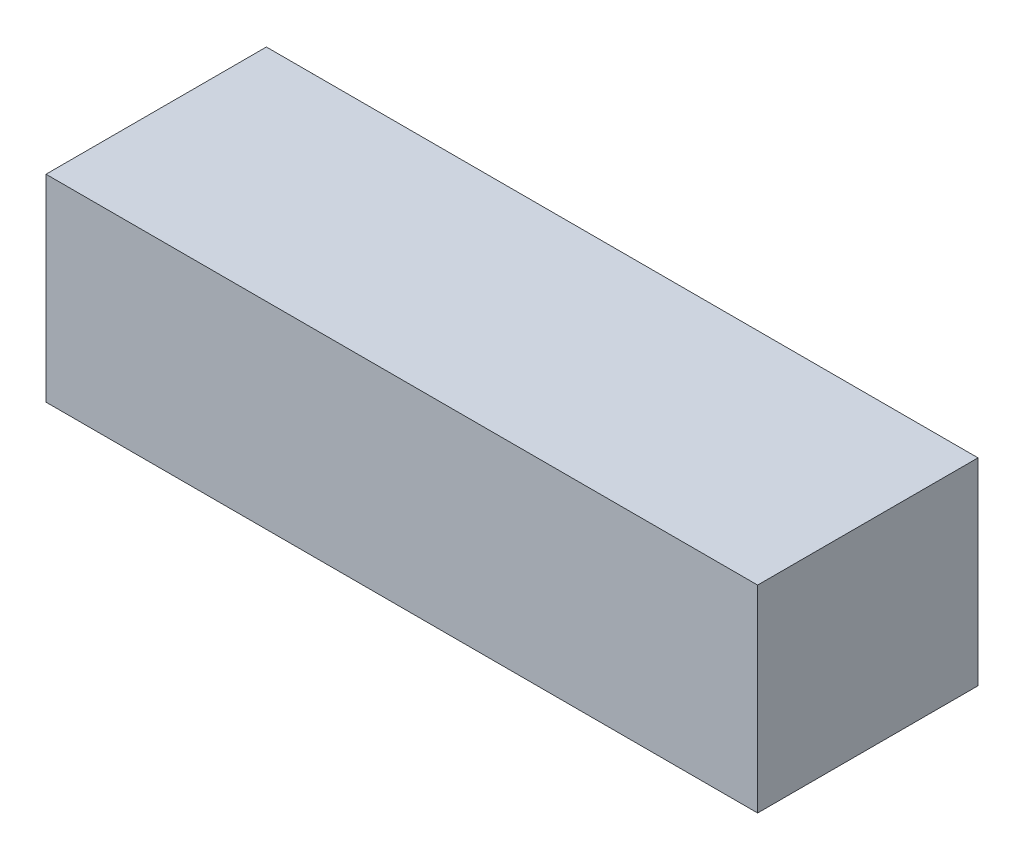
from build123d import *

# Parameters (mm, degrees)
SCHIZZO1_W                   = 155
SCHIZZO1_H                   = 48
ESTRUSIONE_ESTRUSIONE1_DEPTH = 43


with BuildPart() as part:
    # Schizzo1 → Estrusione-Estrusione1 (new body)
    with BuildSketch(Plane(origin=(0, 0, 0), x_dir=(1, 0, 0), z_dir=(0, 1, 0))):
        Rectangle(SCHIZZO1_W, SCHIZZO1_H)
    extrude(amount=ESTRUSIONE_ESTRUSIONE1_DEPTH)


solid = part.part
